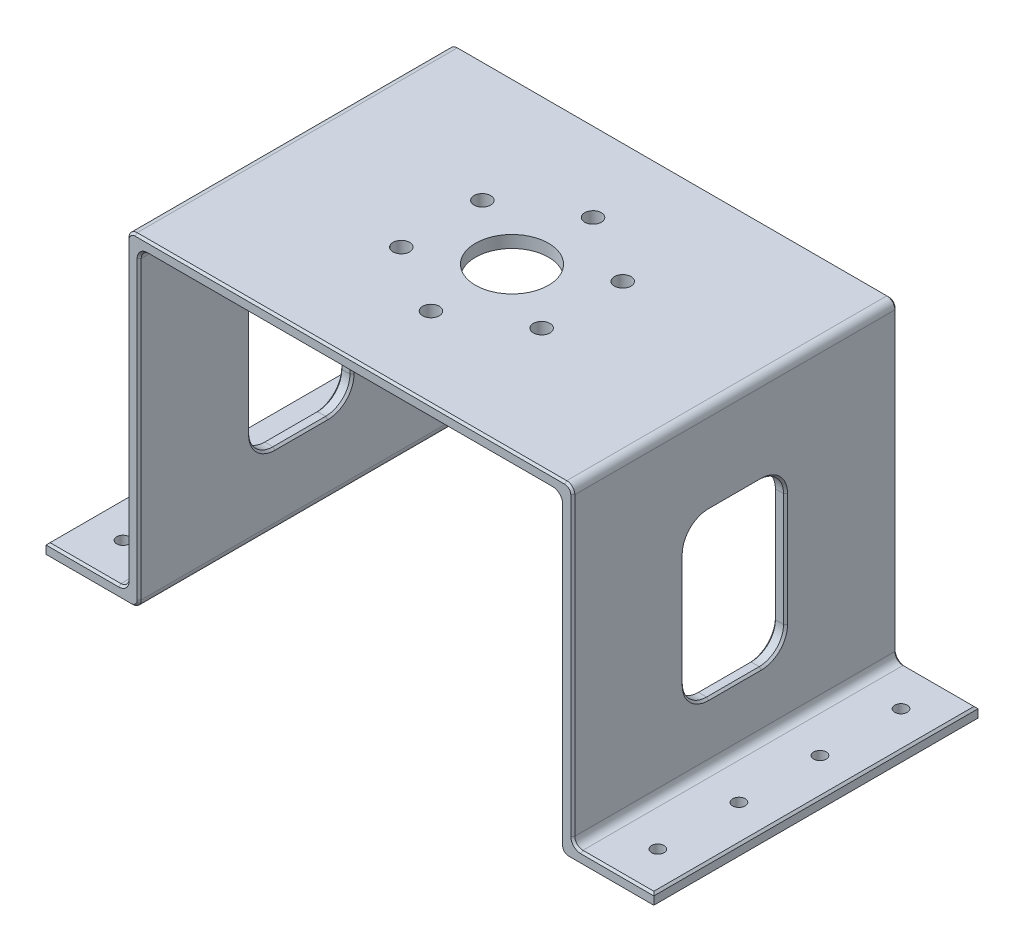
from build123d import *

# Parameters (mm, degrees)
EXTRUDE_1_DEPTH     = 80
FILLET_1_R          = 2
YAW_REACH           = 137.739
SKETCH_2_R          = 2.05
SKETCH_2_R_2        = 9
CUT_EXTRUDE_2_REACH = 135.993
SKETCH_3_R          = 1.55
SKETCH_4_W          = 25
SKETCH_4_H          = 40
CUT_EXTRUDE_3_DEPTH = 171.96490868
FILLET_2_R          = 6
CHAMFER_1_SIZE      = 0.5


with BuildPart() as part:
    # 草图1 → 凸台-拉伸1 (new body)
    with BuildSketch(Plane.XY):
        Polygon((-52, 0), (52, 0), (52, -77), (75, -77), (75, -74), (55, -74), (55, 3), (-55, 3), (-55, -74), (-75, -74), (-75, -77), (-52, -77), align=None)
    extrude(amount=EXTRUDE_1_DEPTH)

    # 圆角1
    fillet_1_edges = [part.edges().sort_by_distance(p)[0] for p in [
        (52, 0, 40),
        (-52, 0, 40),
        (-52, -77, 40),
        (-55, -74, 40),
        (-55, 3, 40),
        (55, 3, 40),
        (55, -74, 40),
        (52, -77, 40),
    ]]
    fillet(fillet_1_edges, radius=FILLET_1_R)

    # 草图2 → yaw (cut, up to next)
    with BuildSketch(Plane(origin=(0, 3, 0), x_dir=(1, 0, 0), z_dir=(0, 1, 0)), mode=Mode.PRIVATE) as yaw_sk1:
        with Locations(Location((-17.320508076, -30, 0), (0, 0, 270))):
            Circle(SKETCH_2_R)
    yaw_tool1 = extrude(yaw_sk1.sketch, amount=-YAW_REACH, mode=Mode.PRIVATE) & part.part
    # 草图2 → yaw (cut, up to next)
    with BuildSketch(Plane(origin=(0, 3, 0), x_dir=(1, 0, 0), z_dir=(0, 1, 0)), mode=Mode.PRIVATE) as yaw_sk2:
        with Locations(Location((0, -20, 0), (0, 0, 270))):
            Circle(SKETCH_2_R)
    yaw_tool2 = extrude(yaw_sk2.sketch, amount=-YAW_REACH, mode=Mode.PRIVATE) & part.part
    # 草图2 → yaw (cut, up to next)
    with BuildSketch(Plane(origin=(0, 3, 0), x_dir=(1, 0, 0), z_dir=(0, 1, 0)), mode=Mode.PRIVATE) as yaw_sk3:
        with Locations(Location((17.320508076, -30, 0), (0, 0, 270))):
            Circle(SKETCH_2_R)
    yaw_tool3 = extrude(yaw_sk3.sketch, amount=-YAW_REACH, mode=Mode.PRIVATE) & part.part
    # 草图2 → yaw (cut, up to next)
    with BuildSketch(Plane(origin=(0, 3, 0), x_dir=(1, 0, 0), z_dir=(0, 1, 0)), mode=Mode.PRIVATE) as yaw_sk4:
        with Locations(Location((17.320508076, -50, 0), (0, 0, 270))):
            Circle(SKETCH_2_R)
    yaw_tool4 = extrude(yaw_sk4.sketch, amount=-YAW_REACH, mode=Mode.PRIVATE) & part.part
    # 草图2 → yaw (cut, up to next)
    with BuildSketch(Plane(origin=(0, 3, 0), x_dir=(1, 0, 0), z_dir=(0, 1, 0)), mode=Mode.PRIVATE) as yaw_sk5:
        with Locations(Location((0, -40, 0), (0, 0, 270))):
            Circle(SKETCH_2_R_2)
    yaw_tool5 = extrude(yaw_sk5.sketch, amount=-YAW_REACH, mode=Mode.PRIVATE) & part.part
    # 草图2 → yaw (cut, up to next)
    with BuildSketch(Plane(origin=(0, 3, 0), x_dir=(1, 0, 0), z_dir=(0, 1, 0)), mode=Mode.PRIVATE) as yaw_sk6:
        with Locations(Location((0, -60, 0), (0, 0, 270))):
            Circle(SKETCH_2_R)
    yaw_tool6 = extrude(yaw_sk6.sketch, amount=-YAW_REACH, mode=Mode.PRIVATE) & part.part
    # 草图2 → yaw (cut, up to next)
    with BuildSketch(Plane(origin=(0, 3, 0), x_dir=(1, 0, 0), z_dir=(0, 1, 0)), mode=Mode.PRIVATE) as yaw_sk7:
        with Locations(Location((-17.320508076, -50, 0), (0, 0, 270))):
            Circle(SKETCH_2_R)
    yaw_tool7 = extrude(yaw_sk7.sketch, amount=-YAW_REACH, mode=Mode.PRIVATE) & part.part
    add(yaw_tool1.solids().sort_by_distance((-17.320508, 3, 30))[0], mode=Mode.SUBTRACT)
    add(yaw_tool2.solids().sort_by_distance((0, 3, 20))[0], mode=Mode.SUBTRACT)
    add(yaw_tool3.solids().sort_by_distance((17.320508, 3, 30))[0], mode=Mode.SUBTRACT)
    add(yaw_tool4.solids().sort_by_distance((17.320508, 3, 50))[0], mode=Mode.SUBTRACT)
    add(yaw_tool5.solids().sort_by_distance((0, 3, 40))[0], mode=Mode.SUBTRACT)
    add(yaw_tool6.solids().sort_by_distance((0, 3, 60))[0], mode=Mode.SUBTRACT)
    add(yaw_tool7.solids().sort_by_distance((-17.320508, 3, 50))[0], mode=Mode.SUBTRACT)

    # 草图3 → 切除-拉伸2 (cut, up to next)
    with BuildSketch(Plane(origin=(0, -74, 0), x_dir=(1, 0, 0), z_dir=(0, 1, 0)), mode=Mode.PRIVATE) as cut_extrude_2_sk1:
        with Locations(Location((-66, -10, 0), (0, 0, 270))):
            Circle(SKETCH_3_R)
    cut_extrude_2_tool1 = extrude(cut_extrude_2_sk1.sketch, amount=-CUT_EXTRUDE_2_REACH, mode=Mode.PRIVATE) & part.part
    # 草图3 → 切除-拉伸2 (cut, up to next)
    with BuildSketch(Plane(origin=(0, -74, 0), x_dir=(1, 0, 0), z_dir=(0, 1, 0)), mode=Mode.PRIVATE) as cut_extrude_2_sk2:
        with Locations(Location((-66, -30, 0), (0, 0, 270))):
            Circle(SKETCH_3_R)
    cut_extrude_2_tool2 = extrude(cut_extrude_2_sk2.sketch, amount=-CUT_EXTRUDE_2_REACH, mode=Mode.PRIVATE) & part.part
    # 草图3 → 切除-拉伸2 (cut, up to next)
    with BuildSketch(Plane(origin=(0, -74, 0), x_dir=(1, 0, 0), z_dir=(0, 1, 0)), mode=Mode.PRIVATE) as cut_extrude_2_sk3:
        with Locations(Location((-66, -50, 0), (0, 0, 270))):
            Circle(SKETCH_3_R)
    cut_extrude_2_tool3 = extrude(cut_extrude_2_sk3.sketch, amount=-CUT_EXTRUDE_2_REACH, mode=Mode.PRIVATE) & part.part
    # 草图3 → 切除-拉伸2 (cut, up to next)
    with BuildSketch(Plane(origin=(0, -74, 0), x_dir=(1, 0, 0), z_dir=(0, 1, 0)), mode=Mode.PRIVATE) as cut_extrude_2_sk4:
        with Locations(Location((-66, -70, 0), (0, 0, 270))):
            Circle(SKETCH_3_R)
    cut_extrude_2_tool4 = extrude(cut_extrude_2_sk4.sketch, amount=-CUT_EXTRUDE_2_REACH, mode=Mode.PRIVATE) & part.part
    # 草图3 → 切除-拉伸2 (cut, up to next)
    with BuildSketch(Plane(origin=(0, -74, 0), x_dir=(1, 0, 0), z_dir=(0, 1, 0)), mode=Mode.PRIVATE) as cut_extrude_2_sk5:
        with Locations(Location((66, -70, 0), (0, 0, 270))):
            Circle(SKETCH_3_R)
    cut_extrude_2_tool5 = extrude(cut_extrude_2_sk5.sketch, amount=-CUT_EXTRUDE_2_REACH, mode=Mode.PRIVATE) & part.part
    # 草图3 → 切除-拉伸2 (cut, up to next)
    with BuildSketch(Plane(origin=(0, -74, 0), x_dir=(1, 0, 0), z_dir=(0, 1, 0)), mode=Mode.PRIVATE) as cut_extrude_2_sk6:
        with Locations(Location((66, -50, 0), (0, 0, 270))):
            Circle(SKETCH_3_R)
    cut_extrude_2_tool6 = extrude(cut_extrude_2_sk6.sketch, amount=-CUT_EXTRUDE_2_REACH, mode=Mode.PRIVATE) & part.part
    # 草图3 → 切除-拉伸2 (cut, up to next)
    with BuildSketch(Plane(origin=(0, -74, 0), x_dir=(1, 0, 0), z_dir=(0, 1, 0)), mode=Mode.PRIVATE) as cut_extrude_2_sk7:
        with Locations(Location((66, -30, 0), (0, 0, 270))):
            Circle(SKETCH_3_R)
    cut_extrude_2_tool7 = extrude(cut_extrude_2_sk7.sketch, amount=-CUT_EXTRUDE_2_REACH, mode=Mode.PRIVATE) & part.part
    # 草图3 → 切除-拉伸2 (cut, up to next)
    with BuildSketch(Plane(origin=(0, -74, 0), x_dir=(1, 0, 0), z_dir=(0, 1, 0)), mode=Mode.PRIVATE) as cut_extrude_2_sk8:
        with Locations(Location((66, -10, 0), (0, 0, 270))):
            Circle(SKETCH_3_R)
    cut_extrude_2_tool8 = extrude(cut_extrude_2_sk8.sketch, amount=-CUT_EXTRUDE_2_REACH, mode=Mode.PRIVATE) & part.part
    add(cut_extrude_2_tool1.solids().sort_by_distance((-66, -74, 10))[0], mode=Mode.SUBTRACT)
    add(cut_extrude_2_tool2.solids().sort_by_distance((-66, -74, 30))[0], mode=Mode.SUBTRACT)
    add(cut_extrude_2_tool3.solids().sort_by_distance((-66, -74, 50))[0], mode=Mode.SUBTRACT)
    add(cut_extrude_2_tool4.solids().sort_by_distance((-66, -74, 70))[0], mode=Mode.SUBTRACT)
    add(cut_extrude_2_tool5.solids().sort_by_distance((66, -74, 70))[0], mode=Mode.SUBTRACT)
    add(cut_extrude_2_tool6.solids().sort_by_distance((66, -74, 50))[0], mode=Mode.SUBTRACT)
    add(cut_extrude_2_tool7.solids().sort_by_distance((66, -74, 30))[0], mode=Mode.SUBTRACT)
    add(cut_extrude_2_tool8.solids().sort_by_distance((66, -74, 10))[0], mode=Mode.SUBTRACT)

    # 草图4 → 切除-拉伸3 (cut, through all)
    with BuildSketch(Plane.ZY.offset(55)):
        with Locations((40, -39)):
            Rectangle(SKETCH_4_W, SKETCH_4_H)
    extrude(amount=-CUT_EXTRUDE_3_DEPTH, mode=Mode.SUBTRACT)

    # 圆角2
    fillet_2_edges = [part.edges().sort_by_distance(p)[0] for p in [
        (53.5, -19, 52.5),
        (-53.5, -19, 52.5),
        (53.5, -59, 52.5),
        (-53.5, -59, 52.5),
        (53.5, -59, 27.5),
        (-53.5, -59, 27.5),
        (53.5, -19, 27.5),
        (-53.5, -19, 27.5),
    ]]
    fillet(fillet_2_edges, radius=FILLET_2_R)

    # 倒角1
    chamfer_1_edges = [part.edges().sort_by_distance(p)[0] for p in [
        (-64.5, -77, 0),
        (66, -74, 80),
        (66, -74, 0),
        (55, -39, 27.5),
        (52, -39, 27.5),
        (55, -19, 40),
        (52, -19, 40),
        (55, -39, 52.5),
        (52, -39, 52.5),
        (55, -59, 40),
        (52, -59, 40),
        (-55, -59, 40),
        (-52, -59, 40),
        (-55, -39, 27.5),
        (-52, -39, 27.5),
        (-55, -39, 52.5),
        (-52, -39, 52.5),
        (-55, -19, 40),
        (-52, -19, 40),
        (52, -20.757359313, 29.257359313),
        (55, -20.757359313, 29.257359313),
        (52, -20.757359313, 50.742640687),
        (55, -20.757359313, 50.742640687),
        (52, -57.242640687, 50.742640687),
        (55, -57.242640687, 50.742640687),
        (52, -57.242640687, 29.257359313),
        (55, -57.242640687, 29.257359313),
        (-55, -57.242640687, 29.257359313),
        (-52, -57.242640687, 29.257359313),
        (-55, -57.242640687, 50.742640687),
        (-75, -77, 40),
        (-52, -57.242640687, 50.742640687),
        (-55, -20.757359313, 50.742640687),
        (-52, -20.757359313, 50.742640687),
        (-75, -74, 40),
        (-55, -20.757359313, 29.257359313),
        (-52, -20.757359313, 29.257359313),
        (75, -74, 40),
        (75, -77, 40),
        (-64.5, -77, 80),
        (0, 3, 0),
        (0, 3, 80),
        (52, -38.5, 0),
        (0, 0, 0),
        (-52, -38.5, 0),
        (-66, -74, 0),
        (-55, -35.5, 0),
        (55, -35.5, 0),
        (64.5, -77, 0),
        (-52.585786438, -76.414213562, 0),
        (52.585786438, -76.414213562, 0),
        (-54.414213562, 2.414213562, 0),
        (54.414213562, 2.414213562, 0),
        (55, -35.5, 80),
        (52, -38.5, 80),
        (64.5, -77, 80),
        (-55, -35.5, 80),
        (-66, -74, 80),
        (-52, -38.5, 80),
        (0, 0, 80),
        (-52.585786438, -76.414213562, 80),
        (52.585786438, -76.414213562, 80),
        (-54.414213562, 2.414213562, 80),
        (54.414213562, 2.414213562, 80),
        (-51.414213562, -0.585786438, 0),
        (-51.414213562, -0.585786438, 80),
        (51.414213562, -0.585786438, 0),
        (51.414213562, -0.585786438, 80),
        (55.585786438, -73.414213562, 0),
        (55.585786438, -73.414213562, 80),
        (-55.585786438, -73.414213562, 0),
        (-55.585786438, -73.414213562, 80),
    ]]
    chamfer(chamfer_1_edges, length=CHAMFER_1_SIZE)


solid = part.part
